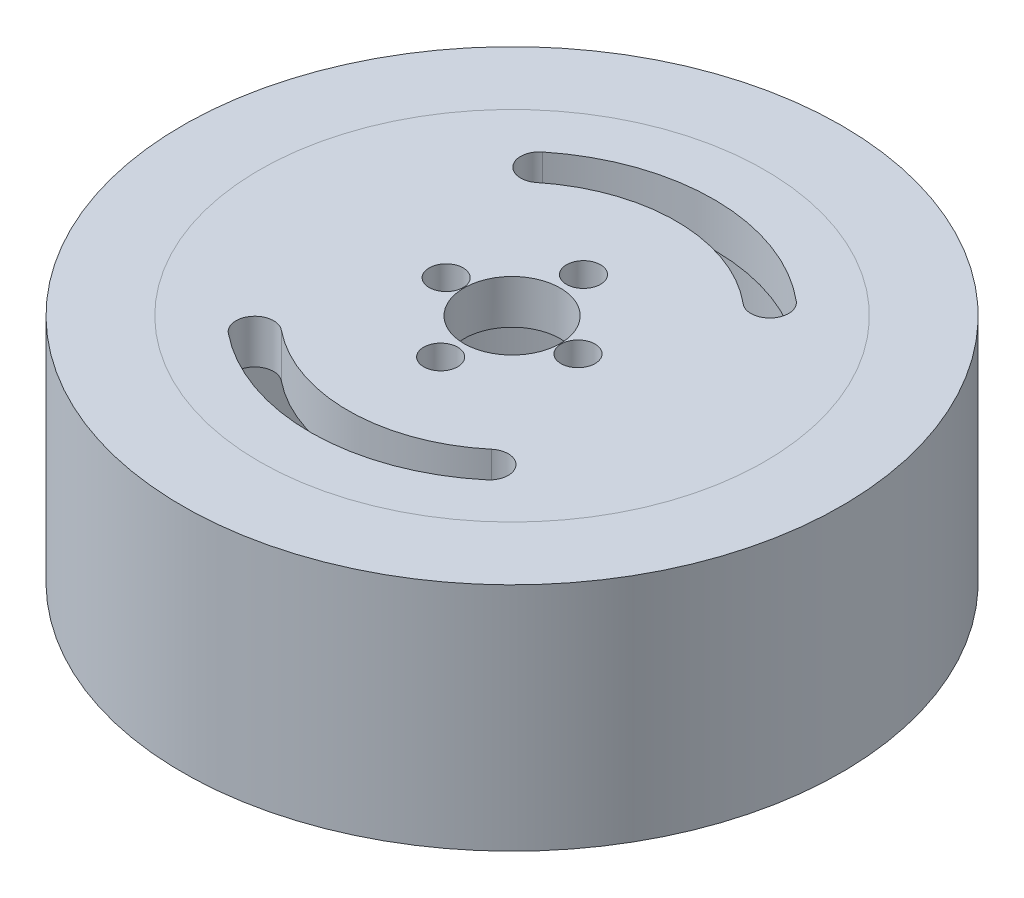
from build123d import *

# Parameters (mm, degrees)
SKETCH_1_R          = 30
EXTRUDE_1_DEPTH     = 21
SKETCH_2_R          = 21
CUT_EXTRUDE_1_DEPTH = 17
SKETCH_4_R          = 1.55
SKETCH_4_R_2        = 4.384489401
CUT_EXTRUDE_3_DEPTH = 17


with BuildPart() as part:
    # 草图1 → 凸台-拉伸1 (new body)
    with BuildSketch(Plane(origin=(0, 0, 0), x_dir=(1, 0, 0), z_dir=(0, 1, 0))):
        with Locations(Location((0, 0, 0), (0, 0, 90))):
            Circle(SKETCH_1_R)
    extrude(amount=EXTRUDE_1_DEPTH)

    # 草图2 → 切除-拉伸1 (cut)
    with BuildSketch(Plane.XZ):
        with Locations(Location((0, 0, 0), (0, 0, 270))):
            Circle(SKETCH_2_R)
    extrude(amount=-CUT_EXTRUDE_1_DEPTH, mode=Mode.SUBTRACT)

    # 草图4 → 切除-拉伸3 (cut)
    with BuildSketch(Plane(origin=(0, 21, 0), x_dir=(1, 0, 0), z_dir=(0, 1, 0))):
        with Locations(Location((-6, 0, 0), (0, 0, 270))):
            Circle(SKETCH_4_R)
        with Locations(Location((0, 6.5, 0), (0, 0, 270))):
            Circle(SKETCH_4_R)
        with Locations(Location((6, 0, 0), (0, 0, 270))):
            Circle(SKETCH_4_R)
        with Locations(Location((0, -6.5, 0), (0, 0, 270))):
            Circle(SKETCH_4_R)
        with Locations(Location((0, 0, 0), (0, 0, 270))):
            Circle(SKETCH_4_R_2)
        with BuildLine():
            ThreePointArc((11.79815708, 14.077346516), (0.167157726, 18.366824813), (-11.539986211, 14.289748551))
            ThreePointArc((-11.539986211, 14.289748551), (-11.796674112, 11.878565481), (-9.385491043, 11.62187758))
            ThreePointArc((-9.385491043, 11.62187758), (0.135949672, 14.93777086), (9.595461863, 11.449130632))
            ThreePointArc((9.595461863, 11.449130632), (12.010917413, 11.661890965), (11.79815708, 14.077346516))
        make_face()
        with BuildLine():
            ThreePointArc((11.79815708, -14.077346516), (0.167157726, -18.366824813), (-11.539986211, -14.289748551))
            ThreePointArc((-11.539986211, -14.289748551), (-11.796674112, -11.878565481), (-9.385491043, -11.62187758))
            ThreePointArc((-9.385491043, -11.62187758), (0.135949672, -14.93777086), (9.595461863, -11.449130632))
            ThreePointArc((9.595461863, -11.449130632), (12.010917413, -11.661890965), (11.79815708, -14.077346516))
        make_face()
    extrude(amount=-CUT_EXTRUDE_3_DEPTH, mode=Mode.SUBTRACT)


solid = part.part
